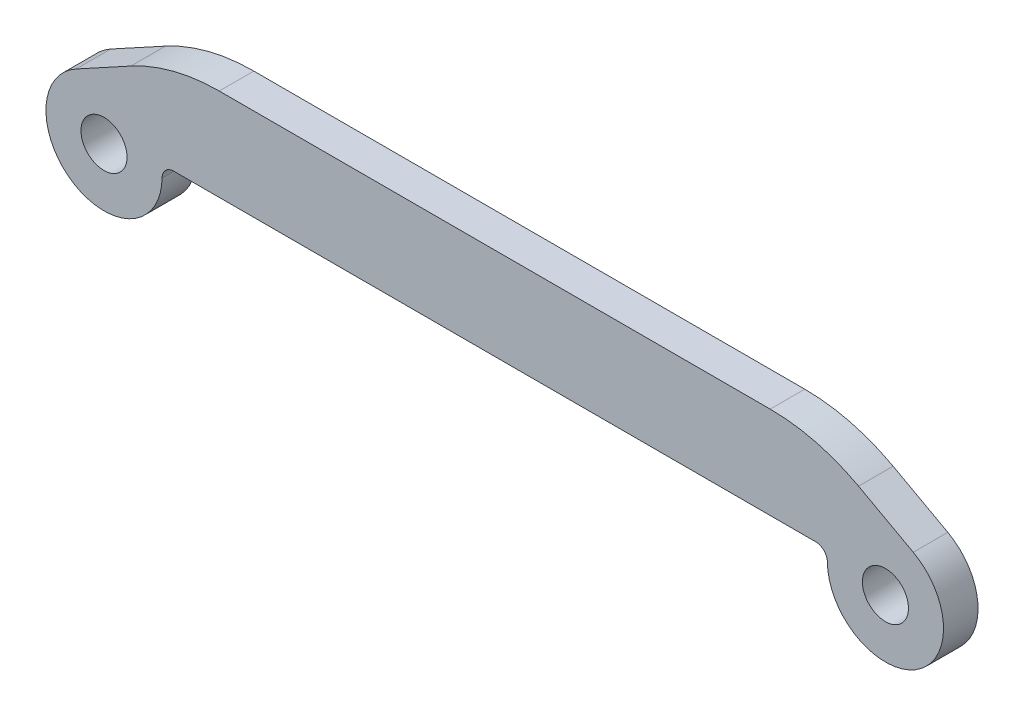
from build123d import *

# Parameters (mm, degrees)
SKETCH1_R           = 1.5875
BOSS_EXTRUDE1_DEPTH = 1.190625
FILLET1_R           = 12.7
FILLET2_R           = 0.8128


with BuildPart() as part:
    # Sketch1 → Boss-Extrude1 (new, symmetric)
    with BuildSketch(Plane.XY):
        with BuildLine():
            Line((-22.9235, -6.35), (22.9235, -6.35))
            Line((22.9235, -6.35), (22.9235, -7.1247))
            ThreePointArc((22.9235, -7.1247), (28.965173596, -10.565282887), (28.841565542, -3.6137254))
            Line((28.841565542, -3.6137254), (22.225, 0))
            Line((22.225, 0), (-22.225, 0))
            Line((-22.225, 0), (-28.841565542, -3.6137254))
            ThreePointArc((-28.841565542, -3.6137254), (-28.965173596, -10.565282887), (-22.9235, -7.1247))
            Line((-22.9235, -7.1247), (-22.9235, -6.35))
        make_face()
        with Locations(Location((-26.924, -7.1247, 0), (0, 0, 180))):
            Circle(SKETCH1_R, mode=Mode.SUBTRACT)
        with Locations(Location((26.924, -7.1247, 0), (0, 0, 180))):
            Circle(SKETCH1_R, mode=Mode.SUBTRACT)
    extrude(amount=BOSS_EXTRUDE1_DEPTH, both=True)

    # Fillet1
    fillet1_edges = [part.edges().sort_by_distance(p)[0] for p in [
        (-22.225, 0, 0),
        (22.225, 0, 0),
    ]]
    fillet(fillet1_edges, radius=FILLET1_R)

    # Fillet2
    fillet2_edges = [part.edges().sort_by_distance(p)[0] for p in [
        (22.9235, -6.35, 0),
        (-22.9235, -6.35, 0),
    ]]
    fillet(fillet2_edges, radius=FILLET2_R)


solid = part.part
